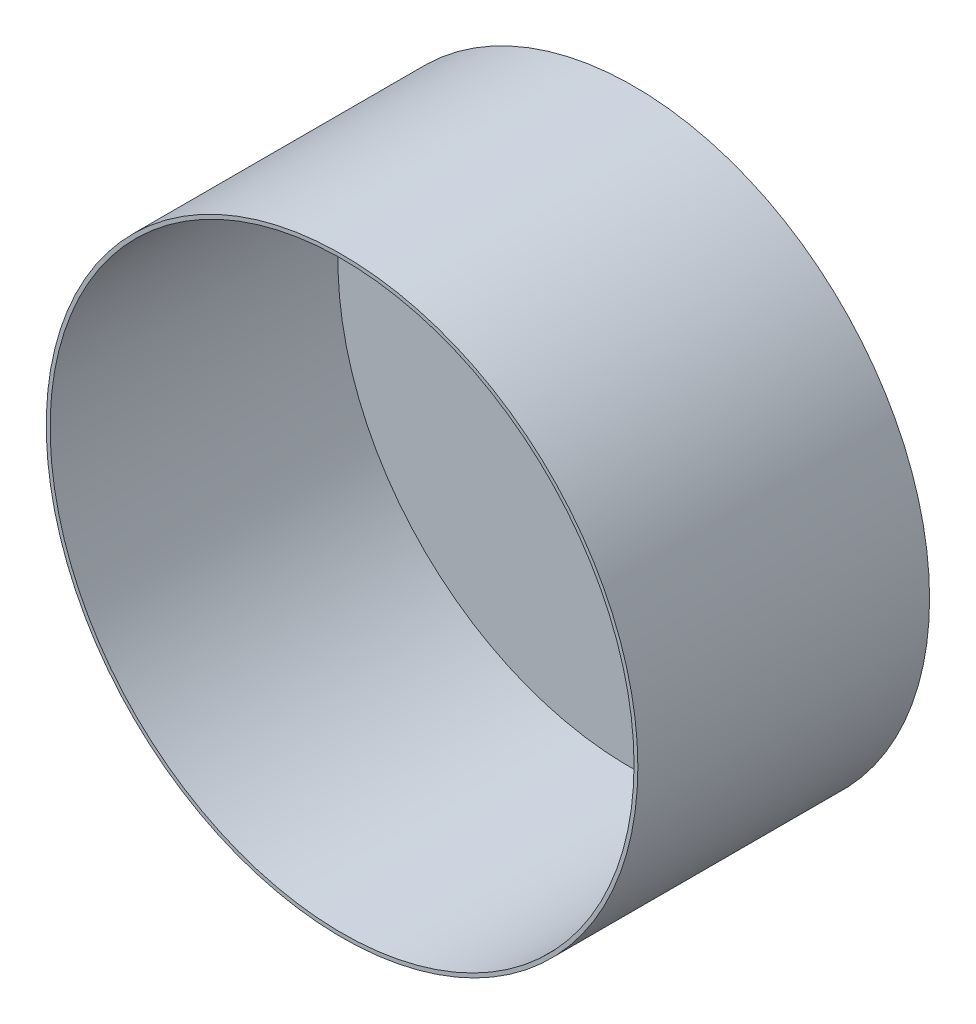
from build123d import *

# Parameters (mm, degrees)
SKETCH2_R           = 38.535
BOSS_EXTRUDE1_DEPTH = 38
SKETCH3_R           = 38.035
CUT_EXTRUDE1_DEPTH  = 37.5


with BuildPart() as part:
    # Sketch2 → Boss-Extrude1 (new body)
    with BuildSketch(Plane.XY):
        Circle(SKETCH2_R)
    extrude(amount=BOSS_EXTRUDE1_DEPTH)

    # Sketch3 → Cut-Extrude1 (cut)
    with BuildSketch(Plane.XY.offset(38)):
        Circle(SKETCH3_R)
    extrude(amount=-CUT_EXTRUDE1_DEPTH, mode=Mode.SUBTRACT)


solid = part.part
